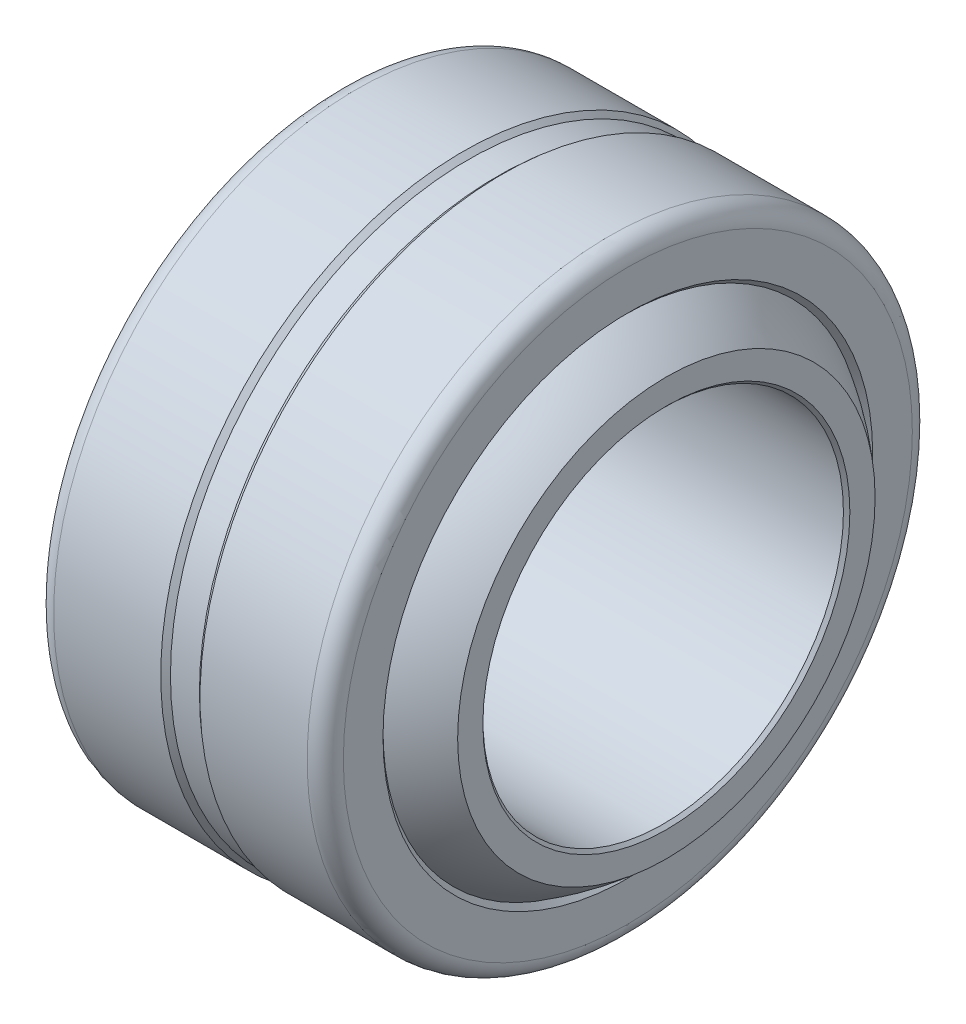
from build123d import *


with BuildPart() as part:
    # Sketch1 → Revolve1 (revolve)
    with BuildSketch(Plane.XY, mode=Mode.PRIVATE) as revolve1_sk:
        with BuildLine():
            Line((-45.212, 51.464994612), (-45.212, 45.241385071))
            Line((-45.212, 45.241385071), (-44.420614929, 44.45))
            Line((-44.420614929, 44.45), (44.420614929, 44.45))
            Line((44.420614929, 44.45), (45.212, 45.241385071))
            Line((45.212, 45.241385071), (45.212, 51.464994612))
            ThreePointArc((45.212, 51.464994612), (40.048905798, 55.577475283), (34.513977442, 59.173946763))
            Line((34.513977442, 59.173946763), (35.7124, 60.372369321))
            Line((35.7124, 60.372369321), (35.7124, 70.14845))
            ThreePointArc((35.7124, 70.14845), (34.404910027, 73.305010027), (31.24835, 74.6125))
            Line((31.24835, 74.6125), (4.843974298, 74.6125))
            Line((4.843974298, 74.6125), (3.57124, 73.4933125))
            Line((3.57124, 73.4933125), (-3.57124, 73.4933125))
            Line((-3.57124, 73.4933125), (-4.843974298, 74.6125))
            Line((-4.843974298, 74.6125), (-31.24835, 74.6125))
            ThreePointArc((-31.24835, 74.6125), (-34.404910027, 73.305010027), (-35.7124, 70.14845))
            Line((-35.7124, 70.14845), (-35.7124, 60.372369321))
            Line((-35.7124, 60.372369321), (-34.513977442, 59.173946763))
            ThreePointArc((-34.513977442, 59.173946763), (-40.048905798, 55.577475283), (-45.212, 51.464994612))
        make_face()
    revolve(revolve1_sk.sketch.rotate(Axis((-45.212, 0, 0), (1, 0, 0)), 270), axis=Axis((-45.212, 0, 0), (1, 0, 0)))


solid = part.part
